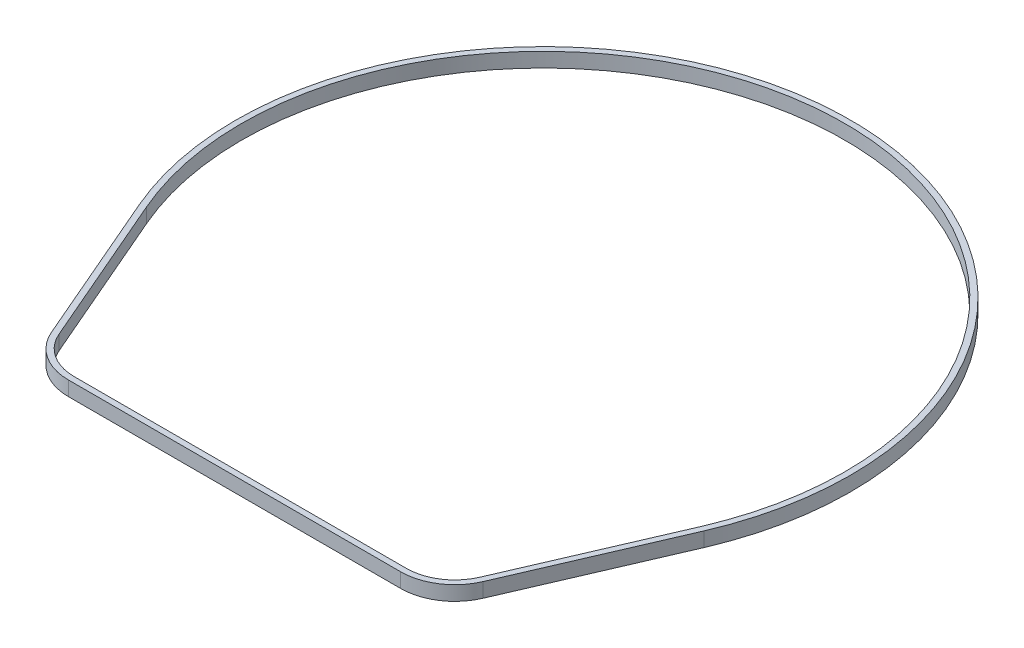
from build123d import *

# Parameters (mm, degrees)
BOSS_EXTRUDE1_DEPTH = 3


with BuildPart() as part:
    # Sketch1 → Boss-Extrude1 (new body)
    with BuildSketch(Plane(origin=(0, 0, 0), x_dir=(1, 0, 0), z_dir=(0, 1, 0))):
        with BuildLine():
            ThreePointArc((34.422746677, -63.95), (40.577345115, -62.107399108), (44.706859879, -57.185878226))
            Line((44.706859879, -57.185878226), (58.490893839, -25.229057412))
            ThreePointArc((58.490893839, -25.229057412), (0, 63.7), (-58.490893839, -25.229057412))
            Line((-58.490893839, -25.229057412), (-44.706859879, -57.185878226))
            ThreePointArc((-44.706859879, -57.185878226), (-40.577345115, -62.107399108), (-34.422746677, -63.95))
            Line((-34.422746677, -63.95), (34.422746677, -63.95))
        make_face()
        with BuildLine():
            Line((34.422746677, -62.75), (-34.422746677, -62.75))
            ThreePointArc((-34.422746677, -62.75), (-39.917923854, -61.104820632), (-43.604990608, -56.710605559))
            Line((-43.604990608, -56.710605559), (-57.389024568, -24.753784745))
            ThreePointArc((-57.389024568, -24.753784745), (-12.637957994, 61.208921063), (62.5, 0))
            ThreePointArc((62.5, 0), (61.208921063, -12.637957994), (57.389024568, -24.753784745))
            Line((57.389024568, -24.753784745), (43.604990608, -56.710605559))
            ThreePointArc((43.604990608, -56.710605559), (39.917923854, -61.104820632), (34.422746677, -62.75))
        make_face(mode=Mode.SUBTRACT)
    extrude(amount=BOSS_EXTRUDE1_DEPTH)


solid = part.part
